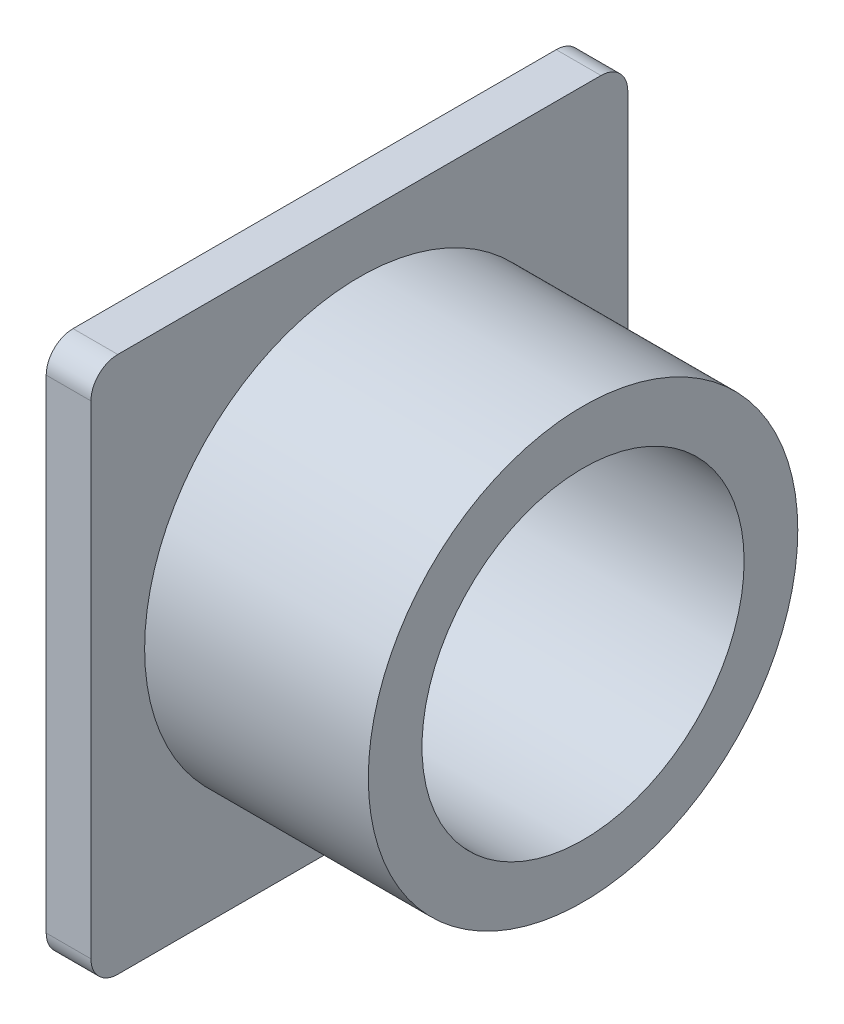
from build123d import *

# Parameters (mm, degrees)
DODANIE_WYCI_GNI_CIE1_DEPTH = 5
SZKIC3_R                    = 24
DODANIE_WYCI_GNI_CIE2_DEPTH = 25
OTW_R_36_0_36_1_D           = 36


with BuildPart() as part:
    # Szkic2 → Dodanie-wyciągnięcie1 (new body)
    with BuildSketch(Plane(origin=(0, 0, 0), x_dir=(0, 0, -1), z_dir=(1, 0, 0))):
        with BuildLine():
            ThreePointArc((0, 57), (0.878679656, 59.121320344), (3, 60))
            Line((3, 60), (57, 60))
            ThreePointArc((57, 60), (59.121320344, 59.121320344), (60, 57))
            Line((60, 57), (60, 3))
            ThreePointArc((60, 3), (59.121320344, 0.878679656), (57, 0))
            Line((57, 0), (3, 0))
            ThreePointArc((3, 0), (0.878679656, 0.878679656), (0, 3))
            Line((0, 3), (0, 57))
        make_face()
    extrude(amount=DODANIE_WYCI_GNI_CIE1_DEPTH)

    # Szkic3 → Dodanie-wyciągnięcie2 (add)
    with BuildSketch(Plane(origin=(5, 0, 0), x_dir=(0, 0, -1), z_dir=(1, 0, 0))):
        with Locations((30, 30)):
            Circle(SZKIC3_R)
    extrude(amount=DODANIE_WYCI_GNI_CIE2_DEPTH)

    # Otwór Ø36.0 (36)1 (through all)
    with Locations(Plane(origin=(30, 0, 0), x_dir=(0, 0, -1), z_dir=(1, 0, 0))):
        with Locations((30, 30)):
            Hole(OTW_R_36_0_36_1_D / 2)


solid = part.part
